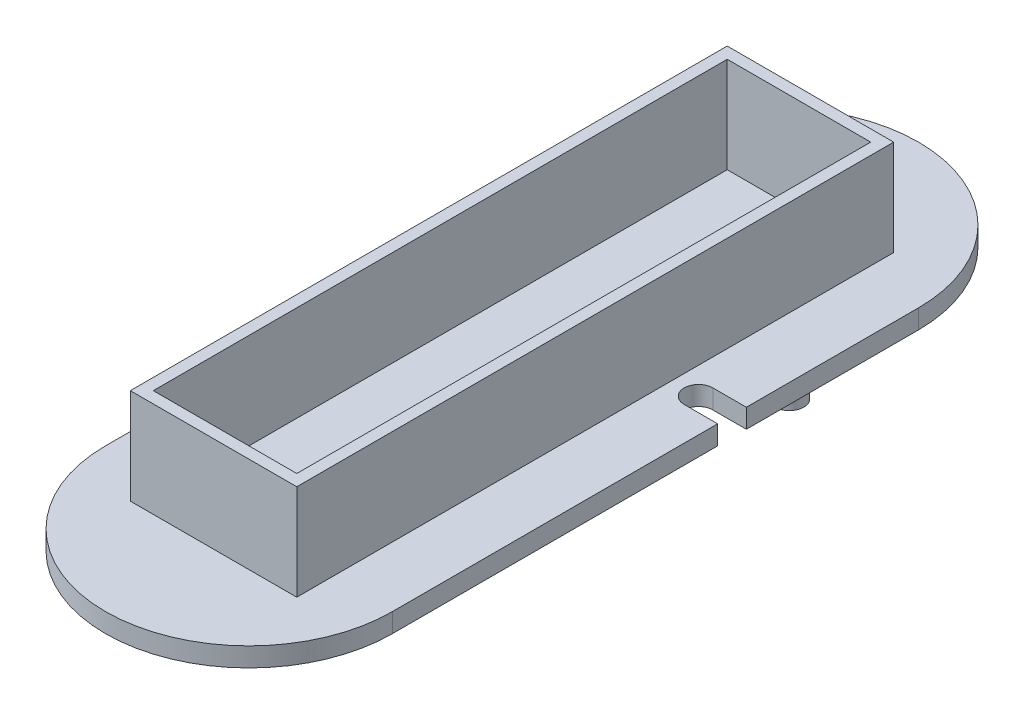
from build123d import *

# Parameters (mm, degrees)
PLATE_EXTRUDE_DEPTH = 2
PEG_SKETCH_R        = 1.5
PEG_EXTRUDE_DEPTH   = 3
SKETCH3_W           = 17.4
SKETCH3_H           = 62.4
SKETCH3_W_2         = 15
SKETCH3_H_2         = 60
BOSS_EXTRUDE3_DEPTH = 10


with BuildPart() as part:
    # Plate Sketch → Plate Extrude (new body)
    with BuildSketch(Plane(origin=(0, 0, 0), x_dir=(1, 0, 0), z_dir=(0, 1, 0))):
        with BuildLine():
            Line((15, 10), (15, -8))
            Line((15, -8), (11.5, -8))
            ThreePointArc((11.5, -8), (10, -9.5), (11.5, -11))
            Line((11.5, -11), (15, -11))
            Line((15, -11), (15, -45))
            ThreePointArc((15, -45), (0, -60), (-15, -45))
            Line((-15, -45), (-15, -11))
            Line((-15, -11), (-11.5, -11))
            ThreePointArc((-11.5, -11), (-10, -9.5), (-11.5, -8))
            Line((-11.5, -8), (-15, -8))
            Line((-15, -8), (-15, 10))
            ThreePointArc((-15, 10), (0, 25), (15, 10))
        make_face()
    extrude(amount=PLATE_EXTRUDE_DEPTH)

    # Peg Sketch → Peg Extrude (add)
    with BuildSketch(Plane.XZ):
        with Locations(Location((11.5, 0, 0), (0, 0, 90))):
            Circle(PEG_SKETCH_R)
        with Locations(Location((-11.5, 0, 0), (0, 0, 90))):
            Circle(PEG_SKETCH_R)
    extrude(amount=PEG_EXTRUDE_DEPTH)

    # Sketch3 → Boss-Extrude3 (add)
    with BuildSketch(Plane(origin=(0, 2, 0), x_dir=(1, 0, 0), z_dir=(0, 1, 0))):
        with Locations((0, -17.5)):
            Rectangle(SKETCH3_W, SKETCH3_H)
        with Locations((0, -17.5)):
            Rectangle(SKETCH3_W_2, SKETCH3_H_2, mode=Mode.SUBTRACT)
    extrude(amount=BOSS_EXTRUDE3_DEPTH)


solid = part.part
